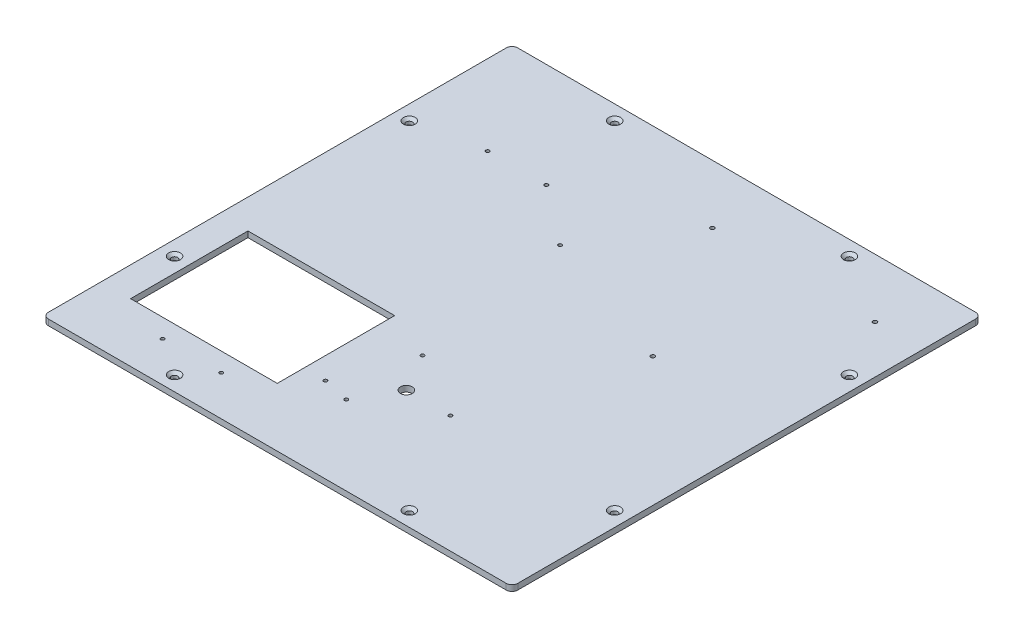
from build123d import *

# Parameters (mm, degrees)
SKETCH1_W                                    = 800
SKETCH1_H                                    = 800
BOSS_EXTRUDE1_DEPTH                          = 10
FILLET1_R                                    = 10
CUT_EXTRUDE1_DEPTH                           = 566.773806393
CUT_EXTRUDE1_DEPTH_BACK                      = 566.773806393
SKETCH2_R                                    = 10
SKETCH2_W                                    = 250
SKETCH2_H                                    = 200
CUT_EXTRUDE5_DEPTH                           = 566.773806393
CUT_EXTRUDE5_DEPTH_BACK                      = 566.773806393
SKETCH6_R                                    = 3
CUT_EXTRUDE6_DEPTH                           = 566.773806393
CUT_EXTRUDE6_DEPTH_BACK                      = 566.773806393
SKETCH7_R                                    = 3
CSK_FOR_M10_COUNTERSUNK_FLAT_HEAD_SC_2_COUNT = 2
CSK_FOR_M10_COUNTERSUNK_FLAT_HEAD_SC_2_PITCH = 400
CSK_FOR_M10_COUNTERSUNK_FLAT_HEAD_SC_3_COUNT = 2
CSK_FOR_M10_COUNTERSUNK_FLAT_HEAD_SC_3_PITCH = 247.487373415
CSK_FOR_M10_COUNTERSUNK_FLAT_HEAD_SC_4_COUNT = 2
CSK_FOR_M10_COUNTERSUNK_FLAT_HEAD_SC_4_PITCH = 601.040764009
CSK_FOR_M10_COUNTERSUNK_FLAT_HEAD_SC_5_COUNT = 2
CSK_FOR_M10_COUNTERSUNK_FLAT_HEAD_SC_5_PITCH = 750
CSK_FOR_M10_COUNTERSUNK_FLAT_HEAD_SC_6_COUNT = 2
CSK_FOR_M10_COUNTERSUNK_FLAT_HEAD_SC_6_PITCH = 850
CSK_FOR_M10_COUNTERSUNK_FLAT_HEAD_SC_7_COUNT = 2
CSK_FOR_M10_COUNTERSUNK_FLAT_HEAD_SC_7_PITCH = 813.172798365
CSK_FOR_M10_COUNTERSUNK_FLAT_HEAD_SC_8_COUNT = 2
CSK_FOR_M10_COUNTERSUNK_FLAT_HEAD_SC_8_PITCH = 601.040764009
M8_TAPPED_HOLE2_D                            = 6.8


with BuildPart() as part:
    # Sketch1 → Boss-Extrude1 (new body)
    with BuildSketch(Plane(origin=(0, 0, 0), x_dir=(1, 0, 0), z_dir=(0, 1, 0))):
        Rectangle(SKETCH1_W, SKETCH1_H)
    extrude(amount=BOSS_EXTRUDE1_DEPTH)

    # Fillet1
    fillet1_edges = [part.edges().sort_by_distance(p)[0] for p in [
        (400, 5, 400),
        (-400, 5, 400),
        (-400, 5, -400),
        (400, 5, -400),
    ]]
    fillet(fillet1_edges, radius=FILLET1_R)

    # Sketch2 → Cut-Extrude1 (cut, two sides: drawn at the far end of the back side and taken through both)
    with BuildSketch(Plane(origin=(0, 10, 0), x_dir=(1, 0, 0), z_dir=(0, 1, 0)).offset(-CUT_EXTRUDE1_DEPTH_BACK)):
        with Locations(Location((20, -200, 0), (0, 0, 270))):
            Circle(SKETCH2_R)
        with Locations((-225, -200)):
            Rectangle(SKETCH2_W, SKETCH2_H)
    extrude(amount=CUT_EXTRUDE1_DEPTH + CUT_EXTRUDE1_DEPTH_BACK, mode=Mode.SUBTRACT)

    # Sketch6 → Cut-Extrude5 (cut, two sides: drawn at the far end of the back side and taken through both)
    with BuildSketch(Plane(origin=(0, 10, 0), x_dir=(1, 0, 0), z_dir=(0, 1, 0)).offset(-CUT_EXTRUDE5_DEPTH_BACK)):
        with Locations(Location((-17.5, -135.048094716, 0), (0, 0, 270))):
            Circle(SKETCH6_R)
        with Locations(Location((-17.5, -264.951905284, 0), (0, 0, 270))):
            Circle(SKETCH6_R)
        with Locations(Location((95, -200, 0), (0, 0, 270))):
            Circle(SKETCH6_R)
    extrude(amount=CUT_EXTRUDE5_DEPTH + CUT_EXTRUDE5_DEPTH_BACK, mode=Mode.SUBTRACT)

    # Sketch7 → Cut-Extrude6 (cut, two sides: drawn at the far end of the back side and taken through both)
    with BuildSketch(Plane.XZ.offset(-CUT_EXTRUDE6_DEPTH_BACK)):
        with Locations(Location((-263.5, 332, 0), (0, 0, 270))):
            Circle(SKETCH7_R)
        with Locations(Location((-163.5, 332, 0), (0, 0, 270))):
            Circle(SKETCH7_R)
        with Locations(Location((-63, 255, 0), (0, 0, 270))):
            Circle(SKETCH7_R)
        with Locations(Location((-63, -145, 0), (0, 0, 270))):
            Circle(SKETCH7_R)
        with Locations(Location((-163.5, -222, 0), (0, 0, 270))):
            Circle(SKETCH7_R)
        with Locations(Location((-263.5, -222, 0), (0, 0, 270))):
            Circle(SKETCH7_R)
    extrude(amount=CUT_EXTRUDE6_DEPTH + CUT_EXTRUDE6_DEPTH_BACK, mode=Mode.SUBTRACT)

    # Sketch12 → CSK for M10 Countersunk Flat Head Screw2 (revolve, cut)
    with BuildSketch(Plane(origin=(200, 10, -375), x_dir=(0, 0, 1), z_dir=(1, 0, 0))):
        Polygon((0, 0), (0, 10), (5.5, 10), (5.5, 4.5), (10, 0), align=None)
    csk_for_m10_countersunk_flat_head_screw2 = revolve(axis=Axis((200, 16.35, -375), (0, -1, 0)), mode=Mode.SUBTRACT)

    # CSK for M10 Countersunk Flat Head Sc 2: CSK for M10 Countersunk Flat Head Screw2 ×2
    with Locations(*[(-i * CSK_FOR_M10_COUNTERSUNK_FLAT_HEAD_SC_2_PITCH, 0, 0) for i in range(1, CSK_FOR_M10_COUNTERSUNK_FLAT_HEAD_SC_2_COUNT)]):
        add(csk_for_m10_countersunk_flat_head_screw2, mode=Mode.SUBTRACT)

    # CSK for M10 Countersunk Flat Head Sc 3: CSK for M10 Countersunk Flat Head Screw2 ×2
    with Locations(*[Vector(0.7071067811865477, 0, 0.7071067811865475) * (i * CSK_FOR_M10_COUNTERSUNK_FLAT_HEAD_SC_3_PITCH) for i in range(1, CSK_FOR_M10_COUNTERSUNK_FLAT_HEAD_SC_3_COUNT)]):
        add(csk_for_m10_countersunk_flat_head_screw2, mode=Mode.SUBTRACT)

    # CSK for M10 Countersunk Flat Head Sc 4: CSK for M10 Countersunk Flat Head Screw2 ×2
    with Locations(*[Vector(0.29116161578269617, 0, 0.9566738804288585) * (i * CSK_FOR_M10_COUNTERSUNK_FLAT_HEAD_SC_4_PITCH) for i in range(1, CSK_FOR_M10_COUNTERSUNK_FLAT_HEAD_SC_4_COUNT)]):
        add(csk_for_m10_countersunk_flat_head_screw2, mode=Mode.SUBTRACT)

    # CSK for M10 Countersunk Flat Head Sc 5: CSK for M10 Countersunk Flat Head Screw2 ×2
    with Locations(*[(0, 0, i * CSK_FOR_M10_COUNTERSUNK_FLAT_HEAD_SC_5_PITCH) for i in range(1, CSK_FOR_M10_COUNTERSUNK_FLAT_HEAD_SC_5_COUNT)]):
        add(csk_for_m10_countersunk_flat_head_screw2, mode=Mode.SUBTRACT)

    # CSK for M10 Countersunk Flat Head Sc 6: CSK for M10 Countersunk Flat Head Screw2 ×2
    with Locations(*[Vector(-0.47058823529411764, 0, 0.8823529411764706) * (i * CSK_FOR_M10_COUNTERSUNK_FLAT_HEAD_SC_6_PITCH) for i in range(1, CSK_FOR_M10_COUNTERSUNK_FLAT_HEAD_SC_6_COUNT)]):
        add(csk_for_m10_countersunk_flat_head_screw2, mode=Mode.SUBTRACT)

    # CSK for M10 Countersunk Flat Head Sc 7: CSK for M10 Countersunk Flat Head Screw2 ×2
    with Locations(*[Vector(-0.7071067811865476, 0, 0.7071067811865476) * (i * CSK_FOR_M10_COUNTERSUNK_FLAT_HEAD_SC_7_PITCH) for i in range(1, CSK_FOR_M10_COUNTERSUNK_FLAT_HEAD_SC_7_COUNT)]):
        add(csk_for_m10_countersunk_flat_head_screw2, mode=Mode.SUBTRACT)

    # CSK for M10 Countersunk Flat Head Sc 8: CSK for M10 Countersunk Flat Head Screw2 ×2
    with Locations(*[Vector(-0.9566738804288585, 0, 0.291161615782696) * (i * CSK_FOR_M10_COUNTERSUNK_FLAT_HEAD_SC_8_PITCH) for i in range(1, CSK_FOR_M10_COUNTERSUNK_FLAT_HEAD_SC_8_COUNT)]):
        add(csk_for_m10_countersunk_flat_head_screw2, mode=Mode.SUBTRACT)

    # M8 Tapped Hole2 (through all)
    with Locations(Plane(origin=(0, 10, 0), x_dir=(1, 0, 0), z_dir=(0, 1, 0))):
        with Locations((180, 60), (41.435935394, 300), (318.564064606, 300)):
            Hole(M8_TAPPED_HOLE2_D / 2)


solid = part.part
